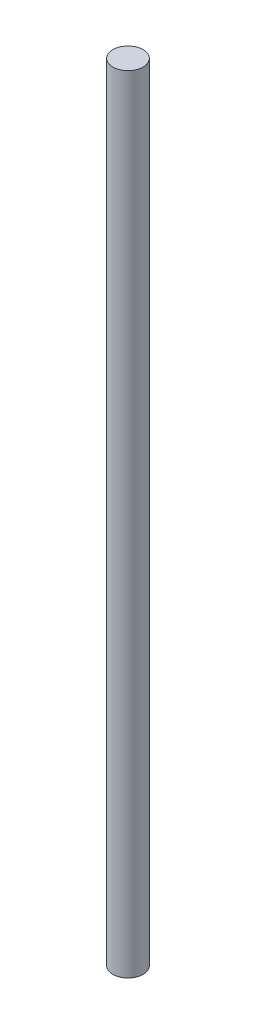
from build123d import *

# Parameters (mm, degrees)
SKETCH1_R           = 3.175
BOSS_EXTRUDE1_DEPTH = 165


with BuildPart() as part:
    # Sketch1 → Boss-Extrude1 (new body)
    with BuildSketch(Plane(origin=(0, 0, 0), x_dir=(1, 0, 0), z_dir=(0, 1, 0))):
        with Locations(Location((0, 0, 0), (0, 0, 270))):
            Circle(SKETCH1_R)
    extrude(amount=BOSS_EXTRUDE1_DEPTH)


solid = part.part
